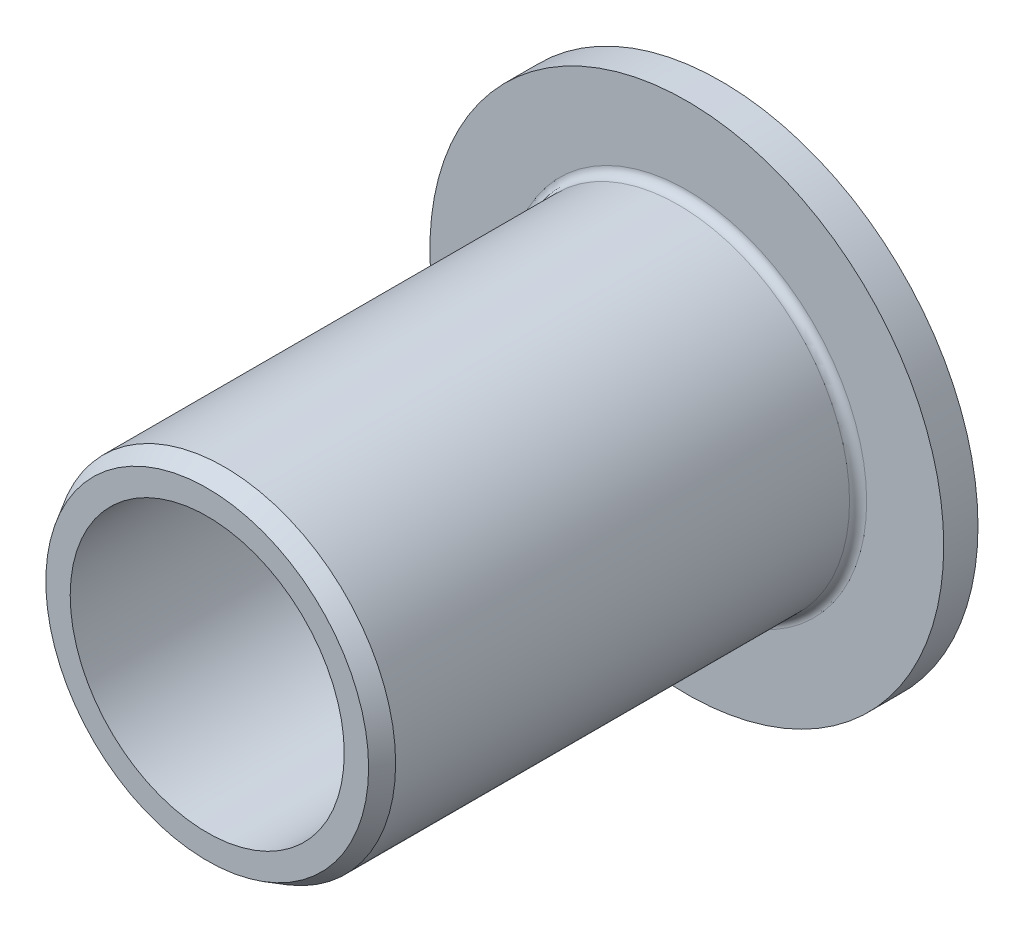
from build123d import *

# Parameters (mm, degrees)
FILLET1_R = 0.25


with BuildPart() as part:
    # Sketch1 → Revolve1 (revolve)
    with BuildSketch(Plane(origin=(0, 0, 0), x_dir=(-1, 0, 0), z_dir=(0, 1, 0))):
        Polygon((-5, 1), (-7.5, 1), (-7.5, 0), (-4, 0), (-4, 15), (-4.711324865, 15), (-5, 14.5), align=None)
    revolve(axis=Axis((0, 0, 0), (0, 0, 1)))

    # Fillet1
    fillet1_edges = [part.edges().sort_by_distance(p)[0] for p in [
        (-5, 0, 1),
    ]]
    fillet(fillet1_edges, radius=FILLET1_R)


solid = part.part
